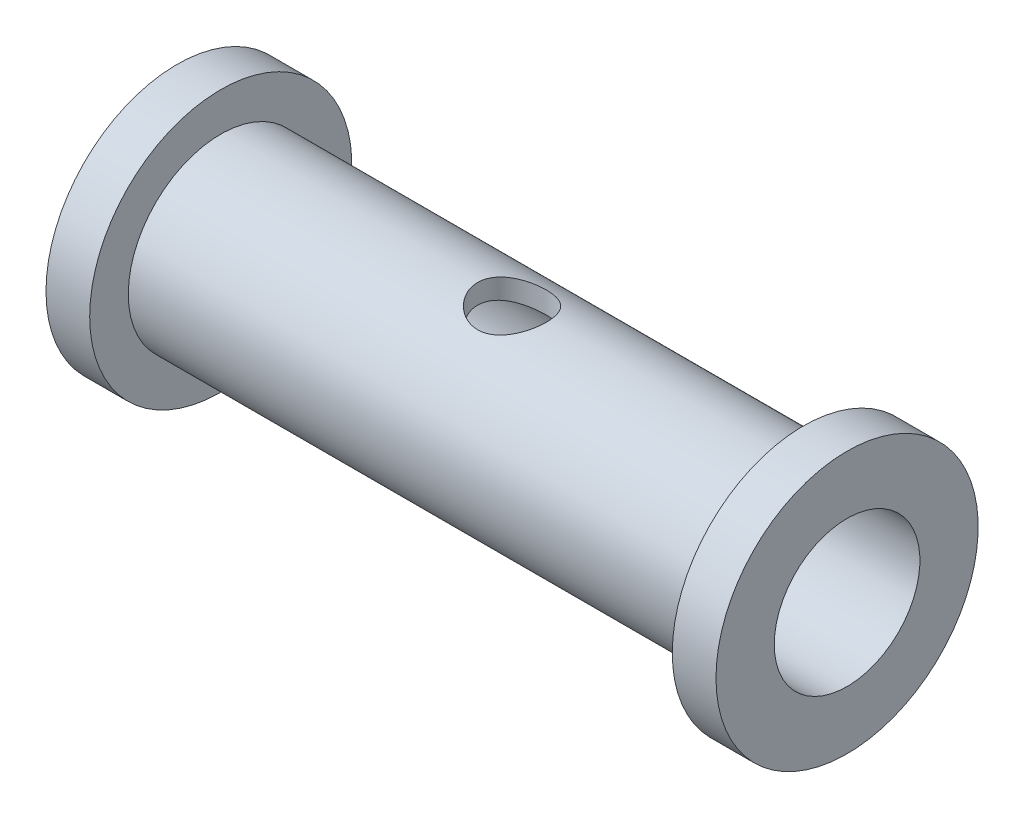
from build123d import *

# Parameters (mm, degrees)
SKETCH2_R          = 1.5
CUT_EXTRUDE1_DEPTH = 17.692168074


with BuildPart() as part:
    # Sketch1 → Revolve1 (revolve)
    with BuildSketch(Plane.XY):
        Polygon((14.605, 3.175), (14.605, 5.715), (12.7, 5.715), (12.7, 4.03225), (-12.7, 4.03225), (-12.7, 5.715), (-14.605, 5.715), (-14.605, 3.175), align=None)
    revolve(axis=Axis((-15.275524476, 0, 0), (1, 0, 0)))

    # Sketch2 → Cut-Extrude1 (cut, through all)
    with BuildSketch(Plane(origin=(0, 0, 0), x_dir=(1, 0, 0), z_dir=(0, 1, 0))):
        Circle(SKETCH2_R)
    extrude(amount=CUT_EXTRUDE1_DEPTH, mode=Mode.SUBTRACT)


solid = part.part
